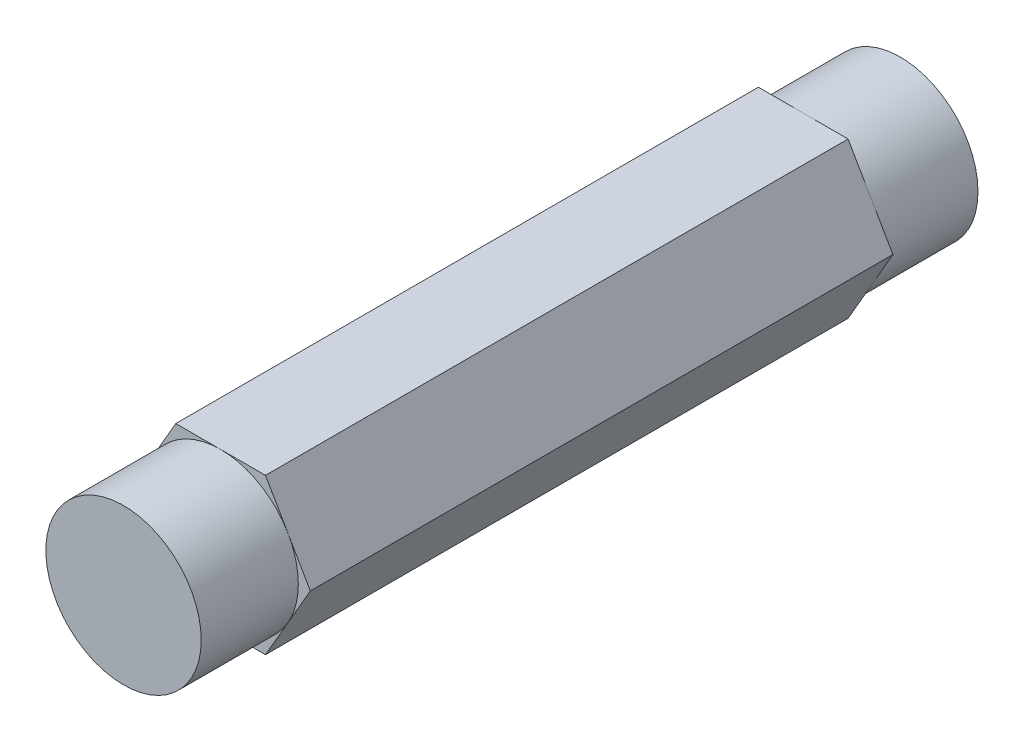
from build123d import *

# Parameters (mm, degrees)
BOSS_EXTRUDE1_DEPTH     = 31.75
SKETCH2_R               = 8.89
SKETCH2_R_2             = 6.35
CUT_EXTRUDE_THIN1_DEPTH = 7.9375


with BuildPart() as part:
    # Sketch1 → Boss-Extrude1 (new, symmetric)
    with BuildSketch(Plane.XY):
        Polygon((7.332348419, 0), (3.666174209, 6.35), (-3.666174209, 6.35), (-7.332348419, 0), (-3.666174209, -6.35), (3.666174209, -6.35), align=None)
    extrude(amount=BOSS_EXTRUDE1_DEPTH, both=True)

    # Sketch2 → Cut-Extrude-Thin1 (cut)
    with BuildSketch(Plane.XY.offset(31.75)):
        Circle(SKETCH2_R)
        Circle(SKETCH2_R_2, mode=Mode.SUBTRACT)
    cut_extrude_thin1 = extrude(amount=-CUT_EXTRUDE_THIN1_DEPTH, mode=Mode.SUBTRACT)

    # Mirror1: Cut-Extrude-Thin1 across plane
    add(cut_extrude_thin1.mirror(Plane.XY), mode=Mode.SUBTRACT)


solid = part.part
